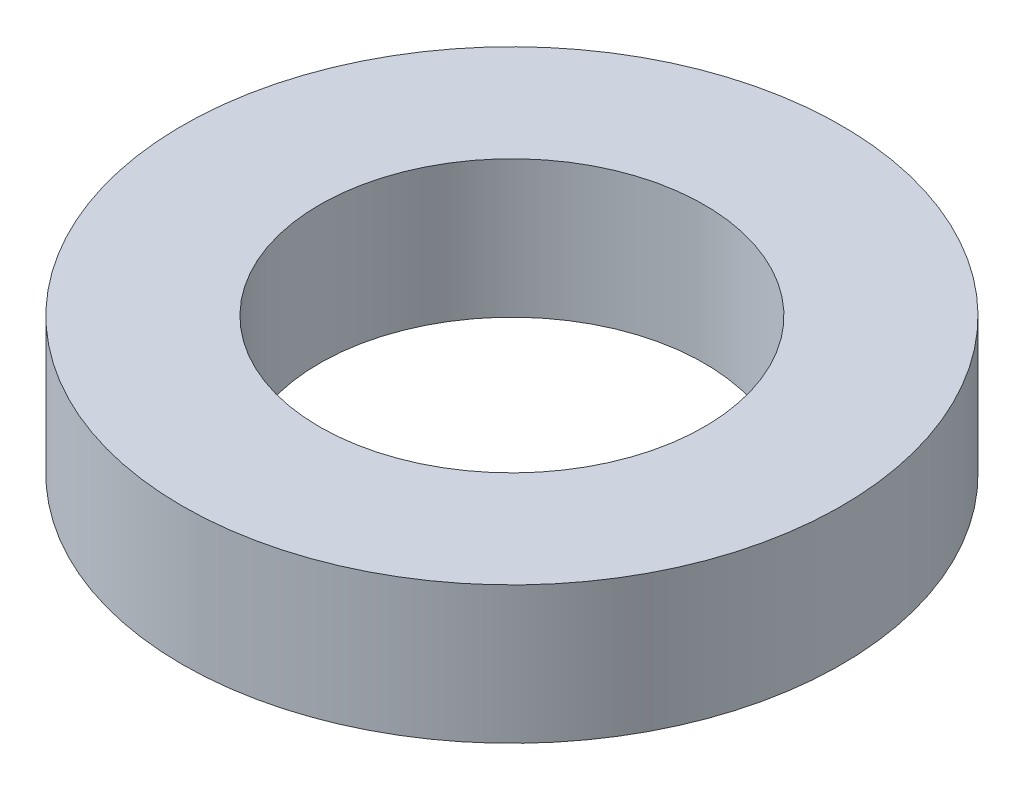
from build123d import *

# Parameters (mm, degrees)
SKETCH1_R           = 24.02
SKETCH1_R_2         = 14.02
BOSS_EXTRUDE1_DEPTH = 10


with BuildPart() as part:
    # Sketch1 → Boss-Extrude1 (new body)
    with BuildSketch(Plane(origin=(0, 0, 0), x_dir=(1, 0, 0), z_dir=(0, 1, 0))):
        with Locations(Location((0, 0, 0), (0, 0, 270))):
            Circle(SKETCH1_R)
        with Locations(Location((0, 0, 0), (0, 0, 270))):
            Circle(SKETCH1_R_2, mode=Mode.SUBTRACT)
    extrude(amount=BOSS_EXTRUDE1_DEPTH)


solid = part.part
